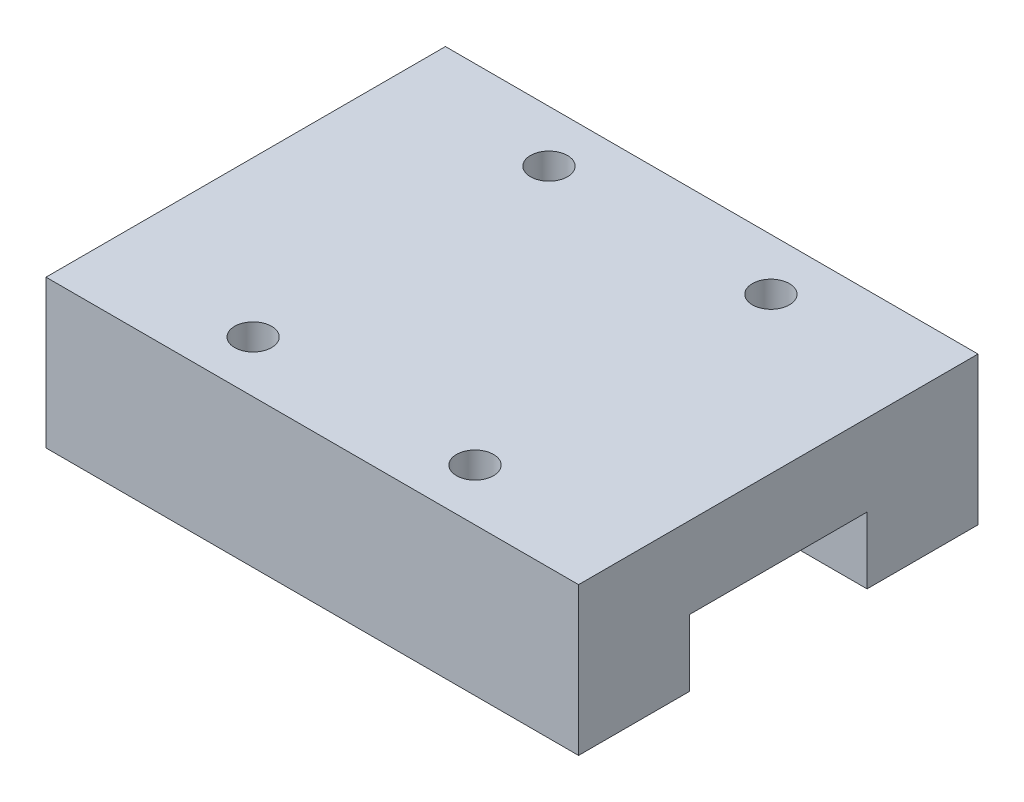
from build123d import *

# Parameters (mm, degrees)
EXTRUDE_1_DEPTH        = 36
HOLE_WIZARD_M3_1_D     = 2.5
HOLE_WIZARD_M3_1_DEPTH = 8.5
HOLE_WIZARD_M3_1_TIP   = 0.751075774


with BuildPart() as part:
    # 草图1 → 拉伸1 (new body)
    with BuildSketch(Plane(origin=(0, 0, 0), x_dir=(0, 0, -1), z_dir=(1, 0, 0))):
        Polygon((6, -10), (13.5, -10), (13.5, 0), (-13.5, 0), (-13.5, -10), (-6, -10), (-6, -5.5), (6, -5.5), align=None)
    extrude(amount=EXTRUDE_1_DEPTH)

    # M3 螺纹孔1
    with Locations(Plane(origin=(10.5, 0, 10), x_dir=(0, 0, 1), z_dir=(0, 1, 0))):
        with Locations((0, 0), (0, 15), (-20, 15), (-20, 0)):
            Hole(HOLE_WIZARD_M3_1_D / 2, depth=HOLE_WIZARD_M3_1_DEPTH)
            with Locations((0, 0, -(HOLE_WIZARD_M3_1_DEPTH + HOLE_WIZARD_M3_1_TIP / 2))):  # 118° drill point
                Cone(0, HOLE_WIZARD_M3_1_D / 2, HOLE_WIZARD_M3_1_TIP, mode=Mode.SUBTRACT)


solid = part.part
